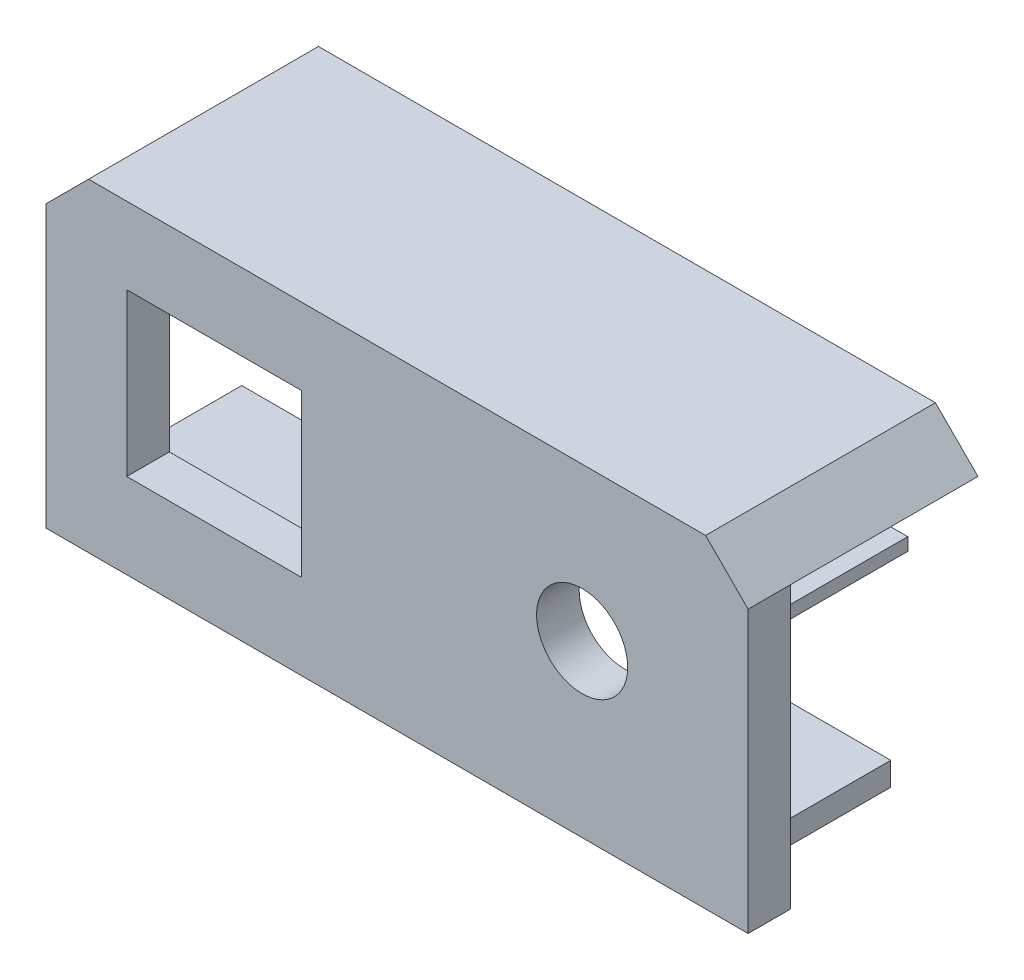
from build123d import *

# Parameters (mm, degrees)
SKETCH1_W           = 82.48
SKETCH1_H           = 33
BOSS_EXTRUDE1_DEPTH = 5
SKETCH2_W           = 82.48
SKETCH2_H           = 5
BOSS_EXTRUDE2_DEPTH = 5
CHAMFER1_SIZE       = 5
CUT_EXTRUDE1_REACH  = 92.95
SKETCH3_R           = 5.35
BOSS_EXTRUDE3_DEPTH = 22
SKETCH5_W           = 21.546115959
SKETCH5_H           = 2.75
SKETCH5_W_2         = 39.193884041
BOSS_EXTRUDE4_DEPTH = 15
SKETCH6_W           = 4
SKETCH6_H           = 23
BOSS_EXTRUDE5_DEPTH = 3
CUT_EXTRUDE2_REACH  = 95.44
SKETCH7_W           = 20.522158998
SKETCH7_H           = 19


with BuildPart() as part:
    # Sketch1 → Boss-Extrude1 (new body)
    with BuildSketch(Plane.XY):
        with Locations((41.24, 16.5)):
            Rectangle(SKETCH1_W, SKETCH1_H)
    extrude(amount=BOSS_EXTRUDE1_DEPTH)

    # Sketch2 → Boss-Extrude2 (add)
    with BuildSketch(Plane(origin=(0, 33, 0), x_dir=(1, 0, 0), z_dir=(0, 1, 0))):
        with Locations((41.24, -2.5)):
            Rectangle(SKETCH2_W, SKETCH2_H)
    extrude(amount=BOSS_EXTRUDE2_DEPTH)

    # Chamfer1
    chamfer1_edges = [part.edges().sort_by_distance(p)[0] for p in [
        (82.48, 38, 2.5),
        (0, 38, 2.5),
    ]]
    chamfer(chamfer1_edges, length=CHAMFER1_SIZE)

    # Sketch3 → Cut-Extrude1 (cut, up to next)
    with BuildSketch(Plane.XY.offset(5), mode=Mode.PRIVATE) as cut_extrude1_sk1:
        with Locations((62.98, 20)):
            Circle(SKETCH3_R)
    cut_extrude1_tool1 = extrude(cut_extrude1_sk1.sketch, amount=-CUT_EXTRUDE1_REACH, mode=Mode.PRIVATE) & part.part
    add(cut_extrude1_tool1.solids().sort_by_distance((62.98, 20, 5))[0], mode=Mode.SUBTRACT)

    # Sketch4 → Boss-Extrude3 (add)
    with BuildSketch(Plane(origin=(0, 0, 0), x_dir=(-1, 0, 0), z_dir=(0, 0, -1))):
        Polygon((-82.48, 33), (0, 33), (-5, 38), (-77.48, 38), align=None)
    extrude(amount=BOSS_EXTRUDE3_DEPTH)

    # Sketch5 → Boss-Extrude4 (add)
    with BuildSketch(Plane(origin=(0, 0, 0), x_dir=(-1, 0, 0), z_dir=(0, 0, -1))):
        Polygon((-79.23, 33), (-77.73, 33), (-77.73, 29.75), (-75.73, 29.75), (-75.73, 28.25), (-81.23, 28.25), (-81.23, 29.75), (-79.23, 29.75), align=None)
        Polygon((-6.49, 33), (-4.99, 33), (-4.99, 29.75), (-2.99, 29.75), (-2.99, 28.25), (-8.49, 28.25), (-8.49, 29.75), (-6.49, 29.75), align=None)
        with Locations((-68.456942021, 4.625)):
            Rectangle(SKETCH5_W, SKETCH5_H)
        with Locations((-22.586942021, 4.625)):
            Rectangle(SKETCH5_W_2, SKETCH5_H)
    extrude(amount=BOSS_EXTRUDE4_DEPTH)

    # Sketch6 → Boss-Extrude5 (add)
    with BuildSketch(Plane(origin=(0, 0, 0), x_dir=(-1, 0, 0), z_dir=(0, 0, -1))):
        with Locations((-49.262158998, 21.5)):
            Rectangle(SKETCH6_W, SKETCH6_H)
        with Locations((-38.262158998, 21.5)):
            Rectangle(SKETCH6_W, SKETCH6_H)
    extrude(amount=BOSS_EXTRUDE5_DEPTH)

    # Sketch7 → Cut-Extrude2 (cut, up to next)
    with BuildSketch(Plane(origin=(0, 0, 0), x_dir=(-1, 0, 0), z_dir=(0, 0, -1)), mode=Mode.PRIVATE) as cut_extrude2_sk1:
        with Locations((-19.751079499, 19.5)):
            Rectangle(SKETCH7_W, SKETCH7_H)
    cut_extrude2_tool1 = extrude(cut_extrude2_sk1.sketch, amount=-CUT_EXTRUDE2_REACH, mode=Mode.PRIVATE) & part.part
    add(cut_extrude2_tool1.solids().sort_by_distance((19.751079, 19.5, 0))[0], mode=Mode.SUBTRACT)


solid = part.part
